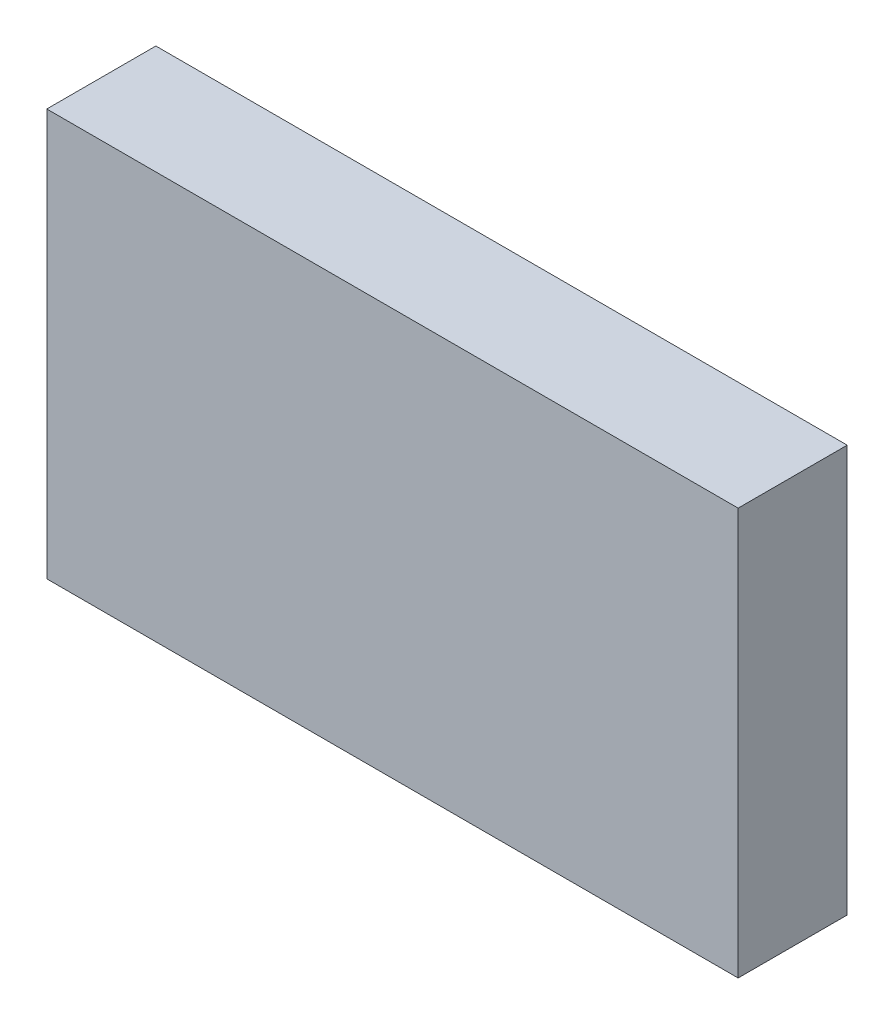
from build123d import *

# Parameters (mm, degrees)
SKETCH1_W           = 63.389806339
SKETCH1_H           = 37.310647478
BOSS_EXTRUDE1_DEPTH = 10


with BuildPart() as part:
    # Sketch1 → Boss-Extrude1 (new body)
    with BuildSketch(Plane.XY):
        with Locations((31.69490317, 18.655323739)):
            Rectangle(SKETCH1_W, SKETCH1_H)
    extrude(amount=BOSS_EXTRUDE1_DEPTH)


solid = part.part
